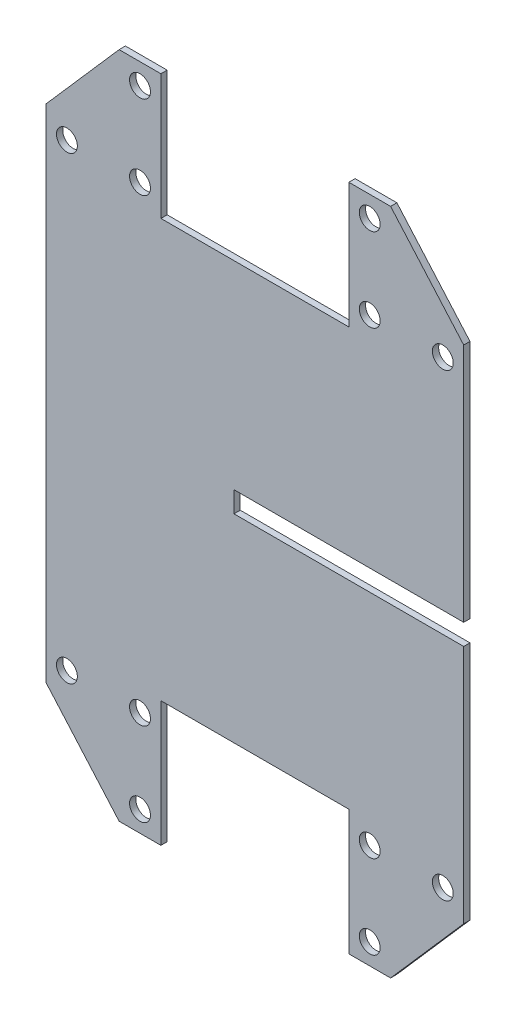
from build123d import *

# Parameters (mm, degrees)
ESQUISSE1_R        = 5
BOSS_EXTRU_1_DEPTH = 3


with BuildPart() as part:
    # Esquisse1 → Boss.-Extru.1 (new body)
    # profile 1 of 3: a face of its own
    with BuildSketch(Plane.XY):
        Polygon((0, 120), (0, 100), (55, 100), (55, 160), (35, 160), align=None)
        with Locations((10, 110)):
            Circle(ESQUISSE1_R, mode=Mode.SUBTRACT)
        with Locations((45, 110)):
            Circle(ESQUISSE1_R, mode=Mode.SUBTRACT)
        with Locations((45, 150)):
            Circle(ESQUISSE1_R, mode=Mode.SUBTRACT)
    # profile 2 of 3: a face of its own
    with BuildSketch(Plane.XY):
        Polygon((55, 100), (0, 100), (0, 0), (90, 0), (90, 5), (200, 5), (200, 80), (200, 100), (145, 100), align=None)
    # profile 3 of 3: a face of its own
    with BuildSketch(Plane.XY):
        Polygon((145, 160), (145, 100), (200, 100), (200, 120), (165, 160), align=None)
        with Locations((155, 110)):
            Circle(ESQUISSE1_R, mode=Mode.SUBTRACT)
        with Locations((190, 110)):
            Circle(ESQUISSE1_R, mode=Mode.SUBTRACT)
        with Locations((155, 150)):
            Circle(ESQUISSE1_R, mode=Mode.SUBTRACT)
    boss_extru_1 = extrude(amount=BOSS_EXTRU_1_DEPTH)

    # Symétrie1: Boss.-Extru.1 across plane
    add(boss_extru_1.mirror(Plane(origin=(0, 0, 3), x_dir=(0, 0, 1), z_dir=(0, 1, 0))))


solid = part.part
